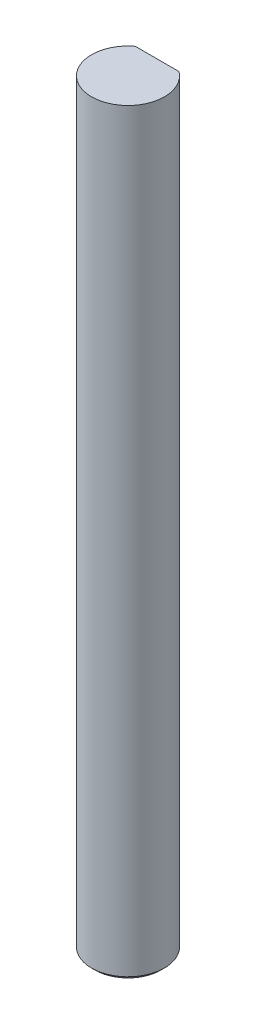
from build123d import *

# Parameters (mm, degrees)
SKETCH_1_R          = 2.5
EXTRUDE_1_DEPTH     = 52
CUT_EXTRUDE_START   = 37
CUT_EXTRUDE_1_DEPTH = 15
CHAMFER_1_SIZE      = 0.25


with BuildPart() as part:
    # 草图1 → 凸台-拉伸1 (new body)
    with BuildSketch(Plane(origin=(0, 0, 0), x_dir=(1, 0, 0), z_dir=(0, 1, 0))):
        with Locations(Location((0, 0, 0), (0, 0, 90))):
            Circle(SKETCH_1_R)
    extrude(amount=EXTRUDE_1_DEPTH)

    # 草图2 → 切除-拉伸1 (cut)
    with BuildSketch(Plane(origin=(0, 0, 0), x_dir=(1, 0, 0), z_dir=(0, 1, 0)).offset(CUT_EXTRUDE_START)):
        with BuildLine():
            Line((-1.5, 2), (1.5, 2))
            ThreePointArc((1.5, 2), (0, 2.5), (-1.5, 2))
        make_face()
    extrude(amount=CUT_EXTRUDE_1_DEPTH, mode=Mode.SUBTRACT)

    # 倒角1
    chamfer_1_edges = [part.edges().sort_by_distance(p)[0] for p in [
        (0, 0, 2.5),
    ]]
    chamfer(chamfer_1_edges, length=CHAMFER_1_SIZE)


solid = part.part
